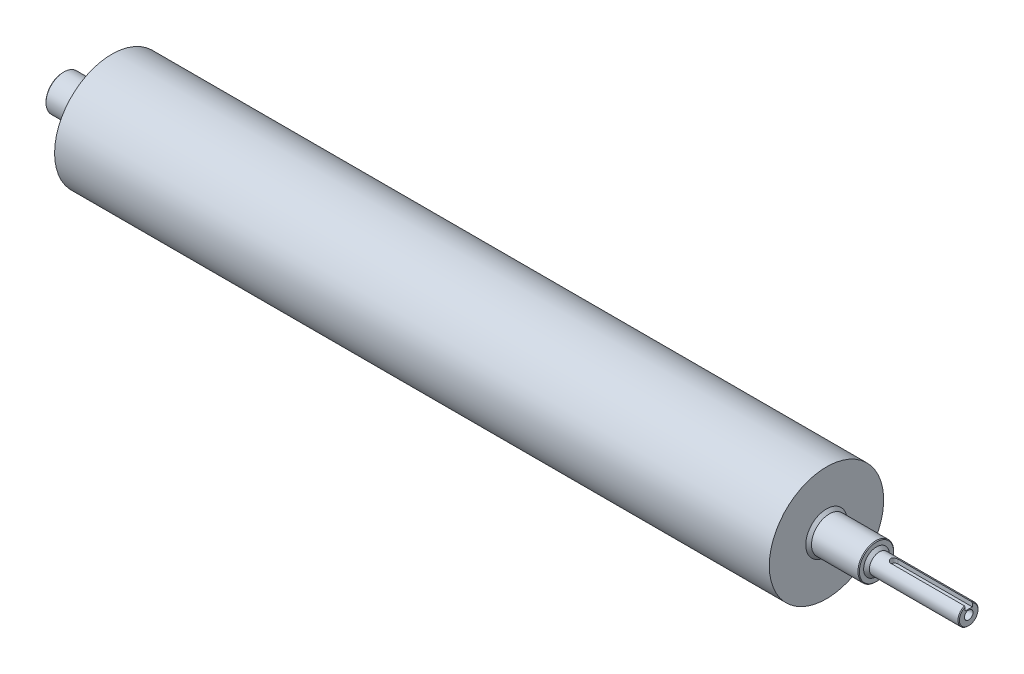
from build123d import *

# Parameters (mm, degrees)
SCHIZZO1_R               = 12.5
ESTRUSIONE1_DEPTH        = 569
SCHIZZO2_R               = 7
ESTRUSIONE2_DEPTH        = 64.5
SCHIZZO3_R               = 3
TAGLIO_ESTRUSIONE1_DEPTH = 20
TAGLIO_ESTRUSIONE2_START = -20
SCHIZZO4_R               = 3
TAGLIO_ESTRUSIONE2_DEPTH = 20
SCHIZZO5_R               = 40
ESTRUSIONE3_DEPTH        = 500
SMUSSO1_SIZE             = 2
SMUSSO2_SIZE             = 0.5
TAGLIO_ESTRUSIONE3_START = -52
TAGLIO_ESTRUSIONE3_DEPTH = 52
TAGLIO_ESTRUSIONE4_DEPTH = 10


with BuildPart() as part:
    # Schizzo1 → Estrusione1 (new body)
    with BuildSketch(Plane(origin=(0, 0, 0), x_dir=(0, 0, -1), z_dir=(1, 0, 0))):
        Circle(SCHIZZO1_R)
    extrude(amount=ESTRUSIONE1_DEPTH)

    # Schizzo2 → Estrusione2 (add)
    with BuildSketch(Plane(origin=(569, 0, 0), x_dir=(0, 0, -1), z_dir=(1, 0, 0))):
        Circle(SCHIZZO2_R)
    extrude(amount=ESTRUSIONE2_DEPTH)

    # Schizzo3 → Taglio-Estrusione1 (cut)
    with BuildSketch(Plane(origin=(633.5, 0, 0), x_dir=(0, 0, -1), z_dir=(1, 0, 0))):
        Circle(SCHIZZO3_R)
    extrude(amount=-TAGLIO_ESTRUSIONE1_DEPTH, mode=Mode.SUBTRACT)

    # Schizzo4 → Taglio-Estrusione2 (cut)
    with BuildSketch(Plane.ZY.offset(TAGLIO_ESTRUSIONE2_START)):
        with Locations(Location((0, 0, 0), (0, 0, 180))):
            Circle(SCHIZZO4_R)
    extrude(amount=TAGLIO_ESTRUSIONE2_DEPTH, mode=Mode.SUBTRACT)

    # Schizzo5 → Estrusione3 (add)
    with BuildSketch(Plane.ZY.offset(-34)):
        Circle(SCHIZZO5_R)
    extrude(amount=-ESTRUSIONE3_DEPTH)

    # Smusso1
    smusso1_edges = [part.edges().sort_by_distance(p)[0] for p in [
        (534, 0, 12.5),
        (34, 0, 12.5),
        (569, 0, 7),
    ]]
    chamfer(smusso1_edges, length=SMUSSO1_SIZE)

    # Smusso2
    smusso2_edges = [part.edges().sort_by_distance(p)[0] for p in [
        (0, 0, 12.5),
        (569, 0, 12.5),
        (633.5, 0, 7),
    ]]
    chamfer(smusso2_edges, length=SMUSSO2_SIZE)

    # Schizzo7 → Taglio-Estrusione3 (cut)
    with BuildSketch(Plane(origin=(633.5, 0, 0), x_dir=(0, 0, -1), z_dir=(1, 0, 0)).offset(TAGLIO_ESTRUSIONE3_START)):
        with BuildLine():
            Line((-2.5, 6.538348415), (-2.5, 3.65))
            Line((-2.5, 3.65), (2.5, 3.65))
            Line((2.5, 3.65), (2.5, 6.538348415))
            ThreePointArc((2.5, 6.538348415), (0, 7), (-2.5, 6.538348415))
        make_face()
    extrude(amount=TAGLIO_ESTRUSIONE3_DEPTH, mode=Mode.SUBTRACT)

    # Schizzo8 → Taglio-Estrusione4 (cut)
    with BuildSketch(Plane(origin=(0, 3.65, 0), x_dir=(1, 0, 0), z_dir=(0, 1, 0))):
        with BuildLine():
            Line((581.5, -2.5), (581.5, 2.5))
            ThreePointArc((581.5, 2.5), (579, 0), (581.5, -2.5))
        make_face()
    extrude(amount=TAGLIO_ESTRUSIONE4_DEPTH, mode=Mode.SUBTRACT)


solid = part.part
